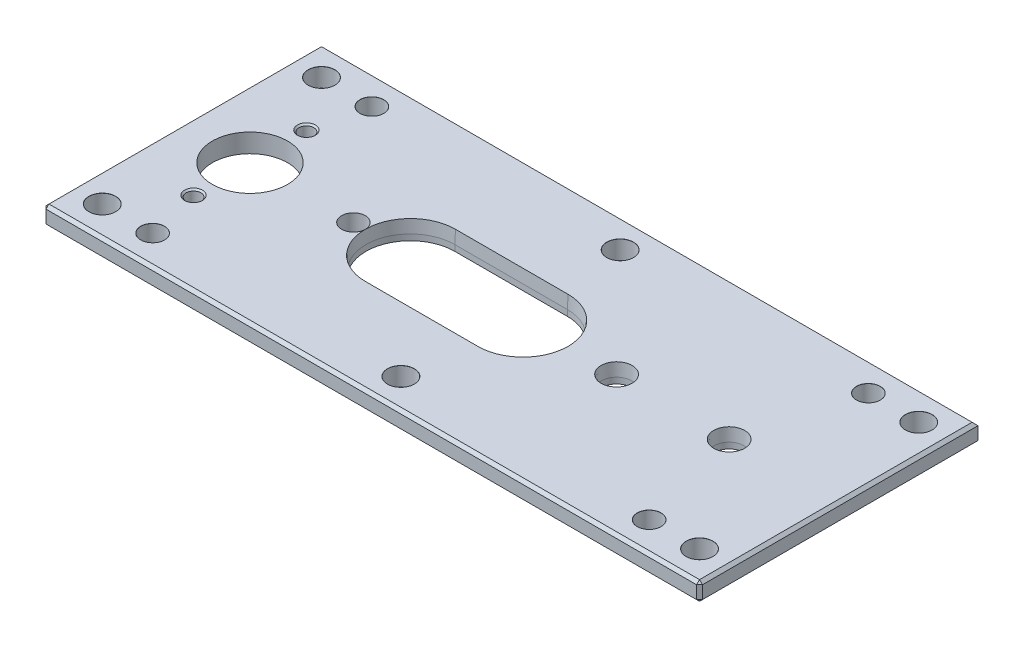
from build123d import *

# Parameters (mm, degrees)
SKETCH1_W                      = 221.6
SKETCH1_H                      = 94
BOSS_EXTRUDE1_DEPTH            = 6.35
CUT_EXTRUDE1_REACH             = 122.524
SKETCH3_R                      = 4
CHAMFER1_SIZE                  = 1
SKETCH6_R                      = 5
CUT_EXTRUDE2_DEPTH             = 121.523700989
CHAMFER2_SIZE                  = 4.35
CHAMFER2_SIZE2                 = 0.22797384
CHAMFER3_SIZE                  = 4.35
CHAMFER3_SIZE2                 = 0.22797384
SKETCH11_R                     = 12.7
CUT_EXTRUDE3_DEPTH             = 121.523700994
M8_CLEARANCE_HOLE1_AT_2_COUNT  = 2
M8_CLEARANCE_HOLE1_AT_2_PITCH  = 74
M8_CLEARANCE_HOLE1_AT_3_COUNT  = 2
M8_CLEARANCE_HOLE1_AT_3_PITCH  = 201.6
M8_CLEARANCE_HOLE1_AT_4_COUNT  = 2
M8_CLEARANCE_HOLE1_AT_4_PITCH  = 214.752322455
M8_CLEARANCE_HOLE1_AT_5_COUNT  = 2
M8_CLEARANCE_HOLE1_AT_5_PITCH  = 100.8
M8_CLEARANCE_HOLE1_AT_6_COUNT  = 2
M8_CLEARANCE_HOLE1_AT_6_PITCH  = 125.046551332
F_8_0MM_DOWEL_HOLE1_AT_2_COUNT = 2
F_8_0MM_DOWEL_HOLE1_AT_2_PITCH = 74
F_8_0MM_DOWEL_HOLE1_AT_3_COUNT = 2
F_8_0MM_DOWEL_HOLE1_AT_3_PITCH = 167.6
F_8_0MM_DOWEL_HOLE1_AT_4_COUNT = 2
F_8_0MM_DOWEL_HOLE1_AT_4_PITCH = 183.209606735
M6_TAPPED_HOLE1_AT_2_COUNT     = 2
M6_TAPPED_HOLE1_AT_2_PITCH     = 38.1


with BuildPart() as part:
    # Sketch1 → Boss-Extrude1 (new body)
    with BuildSketch(Plane(origin=(0, 0, 0), x_dir=(1, 0, 0), z_dir=(0, 1, 0))):
        Rectangle(SKETCH1_W, SKETCH1_H)
    extrude(amount=-BOSS_EXTRUDE1_DEPTH)

    # Sketch3 → Cut-Extrude1 (cut, up to next)
    with BuildSketch(Plane(origin=(0, 0, 0), x_dir=(1, 0, 0), z_dir=(0, 1, 0)), mode=Mode.PRIVATE) as cut_extrude1_sk1:
        with Locations(Location((-53.025, 0, 0), (0, 0, 270))):
            Circle(SKETCH3_R)
    cut_extrude1_tool1 = extrude(cut_extrude1_sk1.sketch, amount=-CUT_EXTRUDE1_REACH, mode=Mode.PRIVATE) & part.part
    add(cut_extrude1_tool1.solids().sort_by_distance((-53.025, 0, 0))[0], mode=Mode.SUBTRACT)

    # Chamfer1
    chamfer1_edges = [part.edges().sort_by_distance(p)[0] for p in [
        (-110.8, -6.35, 0),
        (0, -6.35, 47),
        (110.8, -6.35, 0),
        (0, 0, 47),
        (-110.8, 0, 0),
        (0, 0, -47),
        (110.8, 0, 0),
        (110.8, -3.175, 47),
        (-110.8, -3.175, 47),
        (-110.8, -3.175, -47),
        (0, -6.35, -47),
    ]]
    chamfer(chamfer1_edges, length=CHAMFER1_SIZE)

    # Sketch6 → Cut-Extrude2 (cut, through all)
    with BuildSketch(Plane(origin=(0, 0, 0), x_dir=(1, 0, 0), z_dir=(0, 1, 0))):
        with Locations(Location((73.8, 0, 0), (0, 0, 270))):
            Circle(SKETCH6_R)
        with Locations(Location((35.8, 0, 0), (0, 0, 270))):
            Circle(SKETCH6_R)
        with BuildLine():
            Line((-33.8, 15), (4.2, 15))
            ThreePointArc((4.2, 15), (19.2, 0), (4.2, -15))
            Line((4.2, -15), (-33.8, -15))
            ThreePointArc((-33.8, -15), (-48.8, 0), (-33.8, 15))
        make_face()
    extrude(amount=-CUT_EXTRUDE2_DEPTH, mode=Mode.SUBTRACT)

    # Cut-Sweep1: sweep along a path in Sketch2
    with BuildLine(Plane(origin=(0, 0, 0), x_dir=(1, 0, 0), z_dir=(0, 1, 0))) as cut_sweep1_path:
        Line((-33.8, 15), (4.2, 15))
        ThreePointArc((4.2, 15), (19.2, 0), (4.2, -15))
        Line((4.2, -15), (-33.8, -15))
        ThreePointArc((-33.8, -15), (-48.8, 0), (-33.8, 15))
    # Sketch10 → Cut-Sweep1 (sweep, cut)
    with BuildSketch(Plane(origin=(-33.8, 0, 0), x_dir=(0, 0, -1), z_dir=(1, 0, 0))):
        Polygon((15, -4.35), (15.22797384, 0), (15, 0), align=None)
    sweep(path=cut_sweep1_path.line, mode=Mode.SUBTRACT)

    # Chamfer2
    chamfer2_edges = [part.edges().sort_by_distance(p)[0] for p in [
        (35.8, 0, -5),
    ]]
    chamfer2_side = [part.faces().sort_by_distance(p)[0] for p in [
        (35.8, -3.175, -5),
    ]]
    chamfer(chamfer2_edges, length=CHAMFER2_SIZE, length2=CHAMFER2_SIZE2, reference=chamfer2_side[0])

    # Chamfer3
    chamfer3_edges = [part.edges().sort_by_distance(p)[0] for p in [
        (73.8, 0, -5),
    ]]
    chamfer3_side = [part.faces().sort_by_distance(p)[0] for p in [
        (73.8, -3.175, -5),
    ]]
    chamfer(chamfer3_edges, length=CHAMFER3_SIZE, length2=CHAMFER3_SIZE2, reference=chamfer3_side[0])

    # Sketch11 → Cut-Extrude3 (cut, through all)
    with BuildSketch(Plane(origin=(0, 0, 0), x_dir=(1, 0, 0), z_dir=(0, 1, 0))):
        with Locations(Location((-87.95, 0, 0), (0, 0, 270))):
            Circle(SKETCH11_R)
    extrude(amount=-CUT_EXTRUDE3_DEPTH, mode=Mode.SUBTRACT)

    # Sketch13 → M8 Clearance Hole1 (revolve, cut)
    with BuildSketch(Plane(origin=(-100.8, 0, -37), x_dir=(0, 0, 1), z_dir=(1, 0, 0))):
        Polygon((0, 0), (0, 6.35), (4.525, 6.35), (4.5, 6.325), (4.5, 0.025), (4.525, 0), align=None)
    m8_clearance_hole1 = revolve(axis=Axis((-100.8, 6.35, -37), (0, -1, 0)), mode=Mode.SUBTRACT)

    # M8 Clearance Hole1 at 2: M8 Clearance Hole1 ×2
    with Locations(*[(0, 0, i * M8_CLEARANCE_HOLE1_AT_2_PITCH) for i in range(1, M8_CLEARANCE_HOLE1_AT_2_COUNT)]):
        add(m8_clearance_hole1, mode=Mode.SUBTRACT)

    # M8 Clearance Hole1 at 3: M8 Clearance Hole1 ×2
    with Locations(*[(i * M8_CLEARANCE_HOLE1_AT_3_PITCH, 0, 0) for i in range(1, M8_CLEARANCE_HOLE1_AT_3_COUNT)]):
        add(m8_clearance_hole1, mode=Mode.SUBTRACT)

    # M8 Clearance Hole1 at 4: M8 Clearance Hole1 ×2
    with Locations(*[Vector(0.9387558546280332, 0, 0.34458300219481375) * (i * M8_CLEARANCE_HOLE1_AT_4_PITCH) for i in range(1, M8_CLEARANCE_HOLE1_AT_4_COUNT)]):
        add(m8_clearance_hole1, mode=Mode.SUBTRACT)

    # M8 Clearance Hole1 at 5: M8 Clearance Hole1 ×2
    with Locations(*[(i * M8_CLEARANCE_HOLE1_AT_5_PITCH, 0, 0) for i in range(1, M8_CLEARANCE_HOLE1_AT_5_COUNT)]):
        add(m8_clearance_hole1, mode=Mode.SUBTRACT)

    # M8 Clearance Hole1 at 6: M8 Clearance Hole1 ×2
    with Locations(*[Vector(0.8060997998454218, 0, 0.591779614965885) * (i * M8_CLEARANCE_HOLE1_AT_6_PITCH) for i in range(1, M8_CLEARANCE_HOLE1_AT_6_COUNT)]):
        add(m8_clearance_hole1, mode=Mode.SUBTRACT)

    # Sketch15 → Ø8.0mm Dowel Hole1 (revolve, cut)
    with BuildSketch(Plane(origin=(-83.8, 0, -37), x_dir=(0, 0, 1), z_dir=(1, 0, 0))):
        Polygon((0, 0), (0, 6.35), (4.025, 6.35), (4, 6.325), (4, 0.025), (4.025, 0), align=None)
    f_8_0mm_dowel_hole1 = revolve(axis=Axis((-83.8, 6.35, -37), (0, -1, 0)), mode=Mode.SUBTRACT)

    # Ø8.0mm Dowel Hole1 at 2: Ø8.0mm Dowel Hole1 ×2
    with Locations(*[(0, 0, i * F_8_0MM_DOWEL_HOLE1_AT_2_PITCH) for i in range(1, F_8_0MM_DOWEL_HOLE1_AT_2_COUNT)]):
        add(f_8_0mm_dowel_hole1, mode=Mode.SUBTRACT)

    # Ø8.0mm Dowel Hole1 at 3: Ø8.0mm Dowel Hole1 ×2
    with Locations(*[(i * F_8_0MM_DOWEL_HOLE1_AT_3_PITCH, 0, 0) for i in range(1, F_8_0MM_DOWEL_HOLE1_AT_3_COUNT)]):
        add(f_8_0mm_dowel_hole1, mode=Mode.SUBTRACT)

    # Ø8.0mm Dowel Hole1 at 4: Ø8.0mm Dowel Hole1 ×2
    with Locations(*[Vector(0.9147991908656035, 0, 0.40390895062085114) * (i * F_8_0MM_DOWEL_HOLE1_AT_4_PITCH) for i in range(1, F_8_0MM_DOWEL_HOLE1_AT_4_COUNT)]):
        add(f_8_0mm_dowel_hole1, mode=Mode.SUBTRACT)

    # Sketch17 → M6 Tapped Hole1 (revolve, cut)
    with BuildSketch(Plane(origin=(-87.95, 0, -19.05), x_dir=(0, 0, 1), z_dir=(1, 0, 0))):
        Polygon((0, 0), (0, 6.35), (3.025, 6.35), (2.5, 5.825), (2.5, 0.525), (3.025, 0), align=None)
    m6_tapped_hole1 = revolve(axis=Axis((-87.95, 6.35, -19.05), (0, -1, 0)), mode=Mode.SUBTRACT)

    # M6 Tapped Hole1 at 2: M6 Tapped Hole1 ×2
    with Locations(*[(0, 0, i * M6_TAPPED_HOLE1_AT_2_PITCH) for i in range(1, M6_TAPPED_HOLE1_AT_2_COUNT)]):
        add(m6_tapped_hole1, mode=Mode.SUBTRACT)


solid = part.part
